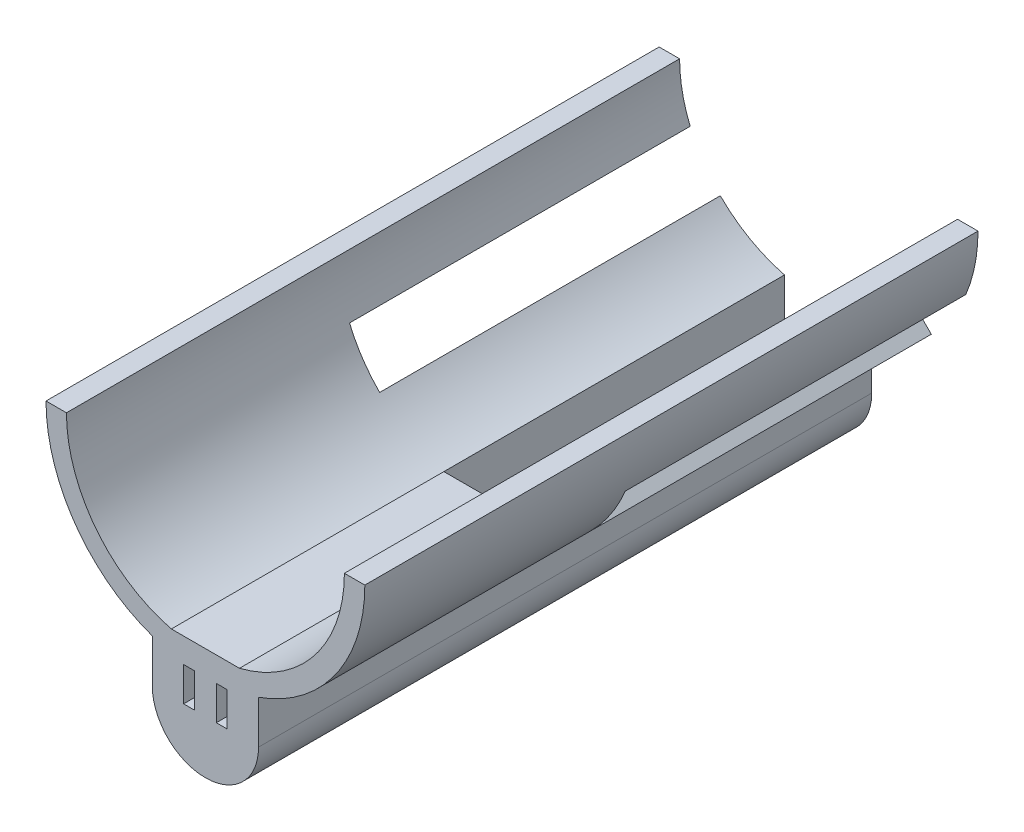
from build123d import *

# Parameters (mm, degrees)
BOSS_EXTRUDE3_DEPTH = 40
BOSS_EXTRUDE7_START = -50
BOSS_EXTRUDE7_DEPTH = 50
BOSS_EXTRUDE8_START = -3
SKETCH3_W           = 1.6
SKETCH3_H           = 5
BOSS_EXTRUDE8_DEPTH = 3
SKETCH5_W           = 10
SKETCH5_H           = 3
BOSS_EXTRUDE9_DEPTH = 37


with BuildPart() as part:
    # Sketch1 → Boss-Extrude3 (new body)
    with BuildSketch(Plane.XY):
        with BuildLine():
            Line((23.4, 0), (20.4, 0))
            ThreePointArc((20.4, 0), (16.095962227, -12.533156027), (5, -19.777765293))
            Line((5, -19.777765293), (5, -28.4))
            ThreePointArc((5, -28.4), (0, -33.4), (-5, -28.4))
            Line((-5, -28.4), (-5, -19.777765293))
            ThreePointArc((-5, -19.777765293), (-16.095962227, -12.533156027), (-20.4, 0))
            Line((-20.4, 0), (-23.4, 0))
            ThreePointArc((-23.4, 0), (-19.106019994, -13.509996299), (-7.8, -22.061731573))
            Line((-7.8, -22.061731573), (-7.8, -28.4))
            ThreePointArc((-7.8, -28.4), (0, -36.2), (7.8, -28.4))
            Line((7.8, -28.4), (7.8, -22.061731573))
            ThreePointArc((7.8, -22.061731573), (19.106019994, -13.509996299), (23.4, 0))
        make_face()
    extrude(amount=BOSS_EXTRUDE3_DEPTH)

    # Sketch1<12> → Boss-Extrude7 (add)
    with BuildSketch(Plane.XY.offset(BOSS_EXTRUDE7_START)):
        with BuildLine():
            Line((23.4, 0), (20.4, 0))
            ThreePointArc((20.4, 0), (20.00801972, -3.979842569), (18.847142463, -7.80674202))
            Line((18.847142463, -7.80674202), (21.618781061, -8.954792317))
            ThreePointArc((21.618781061, -8.954792317), (22.950375561, -4.565113535), (23.4, 0))
        make_face()
        with BuildLine():
            ThreePointArc((-18.847142463, -7.80674202), (-20.00801972, -3.979842569), (-20.4, 0))
            Line((-20.4, 0), (-23.4, 0))
            ThreePointArc((-23.4, 0), (-22.950375561, -4.565113535), (-21.618781061, -8.954792317))
            Line((-21.618781061, -8.954792317), (-18.847142463, -7.80674202))
        make_face()
        with BuildLine():
            Line((16.54629868, -16.54629868), (14.424978336, -14.424978336))
            ThreePointArc((14.424978336, -14.424978336), (10.07449889, -17.738784403), (5, -19.777765293))
            Line((5, -19.777765293), (5, -28.4))
            ThreePointArc((5, -28.4), (0, -33.4), (-5, -28.4))
            Line((-5, -28.4), (-5, -19.777765293))
            ThreePointArc((-5, -19.777765293), (-10.07449889, -17.738784403), (-14.424978336, -14.424978336))
            Line((-14.424978336, -14.424978336), (-16.54629868, -16.54629868))
            ThreePointArc((-16.54629868, -16.54629868), (-12.481609065, -19.793166375), (-7.8, -22.061731573))
            Line((-7.8, -22.061731573), (-7.8, -28.4))
            ThreePointArc((-7.8, -28.4), (0, -36.2), (7.8, -28.4))
            Line((7.8, -28.4), (7.8, -22.061731573))
            ThreePointArc((7.8, -22.061731573), (12.481609065, -19.793166375), (16.54629868, -16.54629868))
        make_face()
    extrude(amount=BOSS_EXTRUDE7_DEPTH)

    # Sketch3 → Boss-Extrude8 (add)
    with BuildSketch(Plane.XY.offset(40).offset(BOSS_EXTRUDE8_START)):
        with BuildLine():
            Line((5, -19.777765293), (-5, -19.777765293))
            Line((-5, -19.777765293), (-5, -28.4))
            ThreePointArc((-5, -28.4), (0, -33.4), (5, -28.4))
            Line((5, -28.4), (5, -19.777765293))
        make_face()
        with Locations((-2.4, -25.9)):
            Rectangle(SKETCH3_W, SKETCH3_H, mode=Mode.SUBTRACT)
        with Locations((2.4, -25.9)):
            Rectangle(SKETCH3_W, SKETCH3_H, mode=Mode.SUBTRACT)
    extrude(amount=BOSS_EXTRUDE8_DEPTH)

    # Sketch5 → Boss-Extrude9 (add)
    with BuildSketch(Plane(origin=(0, 0, 37), x_dir=(-1, 0, 0), z_dir=(0, 0, -1))):
        with Locations((0, -21.277765293)):
            Rectangle(SKETCH5_W, SKETCH5_H)
    extrude(amount=BOSS_EXTRUDE9_DEPTH)


solid = part.part
